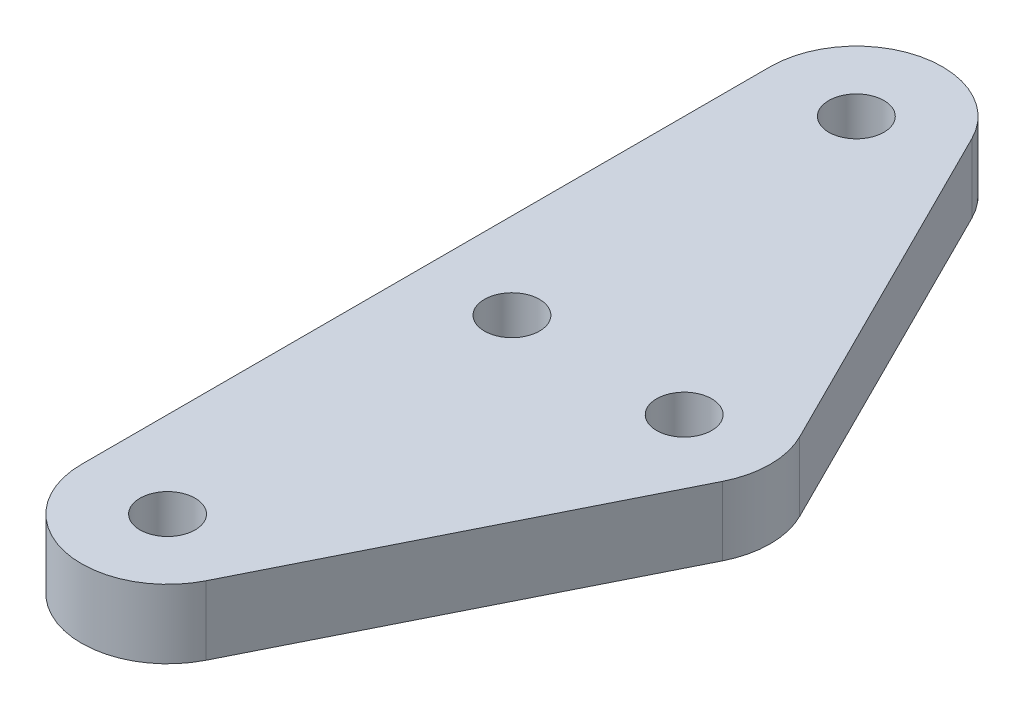
from build123d import *

# Parameters (mm, degrees)
SKETCH1_R           = 1.6
BOSS_EXTRUDE1_DEPTH = 4


with BuildPart() as part:
    # Sketch1 → Boss-Extrude1 (new body)
    with BuildSketch(Plane(origin=(0, 0, 0), x_dir=(1, 0, 0), z_dir=(0, 1, 0))):
        with BuildLine():
            Line((-5, 20), (-5, -20))
            ThreePointArc((-5, -20), (-1.148764603, -24.866244947), (4.472135955, -22.236067977))
            Line((4.472135955, -22.236067977), (14.472135955, -2.236067977))
            ThreePointArc((14.472135955, -2.236067977), (15, 0), (14.472135955, 2.236067977))
            Line((14.472135955, 2.236067977), (4.472135955, 22.236067977))
            ThreePointArc((4.472135955, 22.236067977), (-1.148764603, 24.866244947), (-5, 20))
        make_face()
        with Locations(Location((0, 20, 0), (0, 0, 270))):
            Circle(SKETCH1_R, mode=Mode.SUBTRACT)
        with Locations(Location((0, -20, 0), (0, 0, 270))):
            Circle(SKETCH1_R, mode=Mode.SUBTRACT)
        with Locations(Location((10, 0, 0), (0, 0, 270))):
            Circle(SKETCH1_R, mode=Mode.SUBTRACT)
        with Locations(Location((0, 0, 0), (0, 0, 270))):
            Circle(SKETCH1_R, mode=Mode.SUBTRACT)
    extrude(amount=BOSS_EXTRUDE1_DEPTH)


solid = part.part
